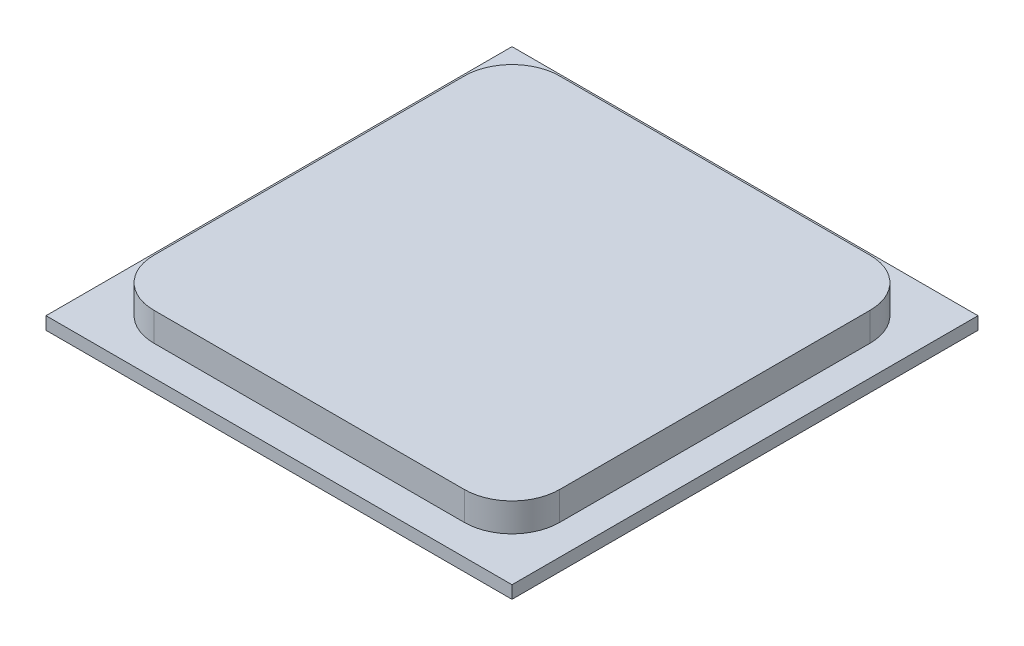
from build123d import *

# Parameters (mm, degrees)
SKETCH_1_W          = 147
SKETCH_1_H          = 147
EXTRUDE_1_DEPTH     = 4
EXTRUDE_2_DEPTH     = 9
SKETCH_3_W          = 103
SKETCH_3_H          = 103
CUT_EXTRUDE_1_DEPTH = 1


with BuildPart() as part:
    # 草图1 → 凸台-拉伸1 (new body)
    with BuildSketch(Plane(origin=(0, 0, 0), x_dir=(1, 0, 0), z_dir=(0, 1, 0))):
        Rectangle(SKETCH_1_W, SKETCH_1_H)
    extrude(amount=EXTRUDE_1_DEPTH)

    # 草图2 → 凸台-拉伸2 (add)
    with BuildSketch(Plane(origin=(0, 4, 0), x_dir=(1, 0, 0), z_dir=(0, 1, 0))):
        with BuildLine():
            Line((49, -64), (-49, -64))
            ThreePointArc((-49, -64), (-59.606601718, -59.606601718), (-64, -49))
            Line((-64, -49), (-64, 49))
            ThreePointArc((-64, 49), (-59.606601718, 59.606601718), (-49, 64))
            Line((-49, 64), (49, 64))
            ThreePointArc((49, 64), (59.606601718, 59.606601718), (64, 49))
            Line((64, 49), (64, -49))
            ThreePointArc((64, -49), (59.606601718, -59.606601718), (49, -64))
        make_face()
    extrude(amount=EXTRUDE_2_DEPTH)

    # 草图3 → 切除-拉伸1 (cut)
    with BuildSketch(Plane.XZ):
        Rectangle(SKETCH_3_W, SKETCH_3_H)
    extrude(amount=-CUT_EXTRUDE_1_DEPTH, mode=Mode.SUBTRACT)


solid = part.part
